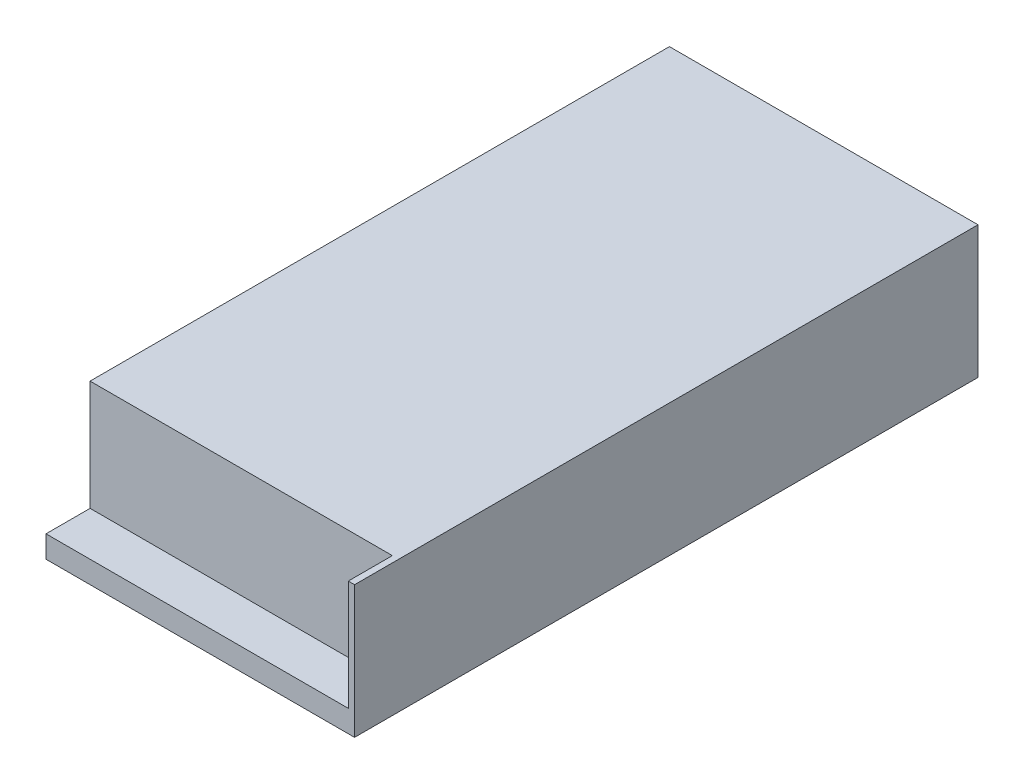
from build123d import *

# Parameters (mm, degrees)
SKETCH1_W           = 98
SKETCH1_H           = 198
BOSS_EXTRUDE1_DEPTH = 42
SKETCH2_W           = 96
SKETCH2_H           = 14
CUT_EXTRUDE1_DEPTH  = 35


with BuildPart() as part:
    # Sketch1 → Boss-Extrude1 (new body)
    with BuildSketch(Plane(origin=(0, 0, 0), x_dir=(1, 0, 0), z_dir=(0, 1, 0))):
        Rectangle(SKETCH1_W, SKETCH1_H)
    extrude(amount=BOSS_EXTRUDE1_DEPTH)

    # Sketch2 → Cut-Extrude1 (cut)
    with BuildSketch(Plane(origin=(0, 42, 0), x_dir=(1, 0, 0), z_dir=(0, 1, 0))):
        with Locations((-1, -92)):
            Rectangle(SKETCH2_W, SKETCH2_H)
    extrude(amount=-CUT_EXTRUDE1_DEPTH, mode=Mode.SUBTRACT)


solid = part.part
